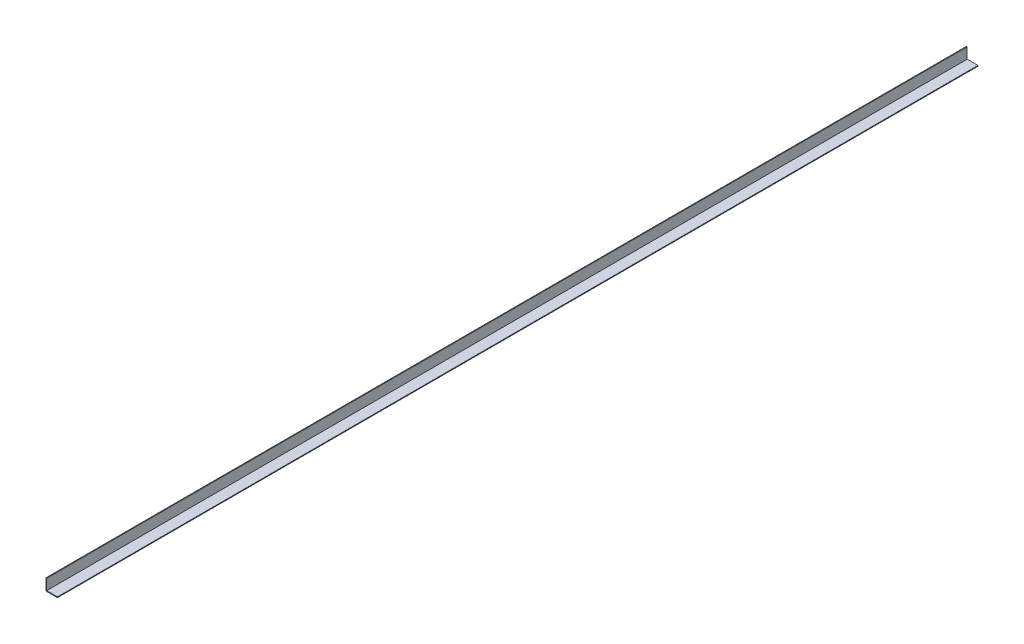
from build123d import *

# Parameters (mm, degrees)
SALIENTE_EXTRUIR1_DEPTH = 6100


with BuildPart() as part:
    # Croquis1 → Saliente-Extruir1 (new body)
    with BuildSketch(Plane.XY):
        Polygon((0, 76.2), (0, 0), (76.2, 0), (76.2, 4.76), (4.76, 4.76), (4.76, 76.2), align=None)
    extrude(amount=-SALIENTE_EXTRUIR1_DEPTH)


solid = part.part
